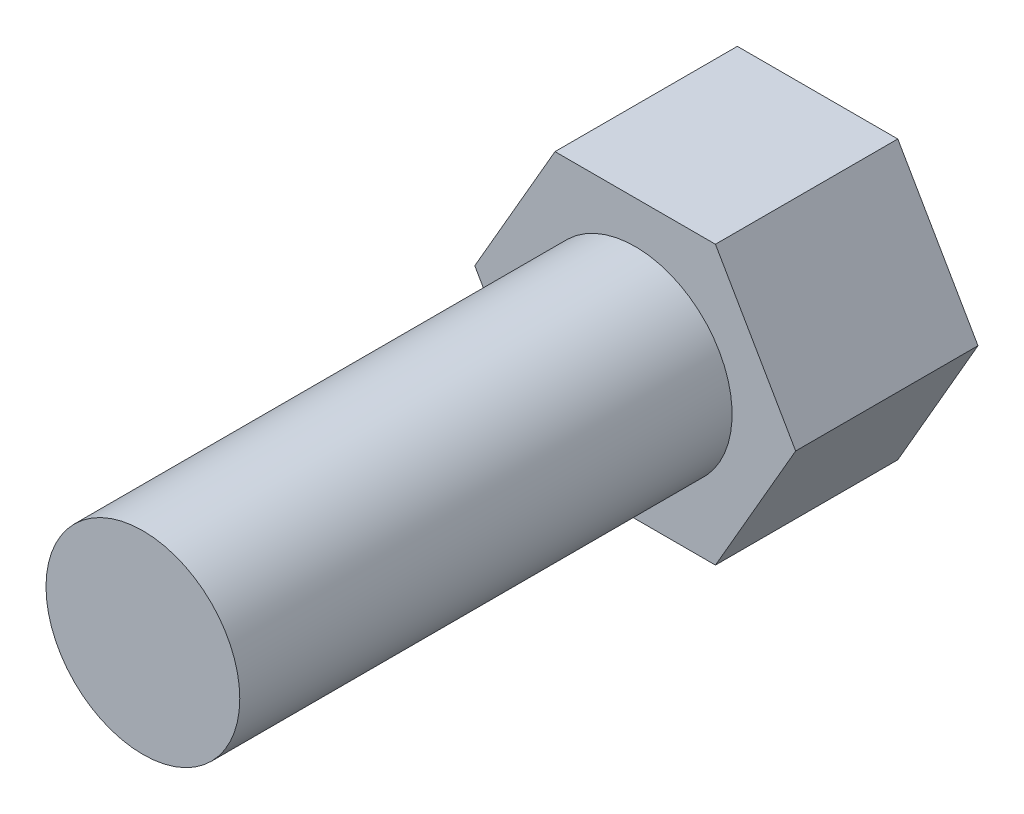
from build123d import *

# Parameters (mm, degrees)
EXTRUDE1_DEPTH      = 1.5
EXTRUDE1_DEPTH_BACK = 3.5
SKETCH2_R           = 2.656835516
EXTRUDE2_DEPTH      = 13.5


with BuildPart() as part:
    # Sketch1 → Extrude1 (new, two sides: drawn at the far end of the back side and taken through both)
    with BuildSketch(Plane.XY.offset(-EXTRUDE1_DEPTH_BACK)):
        Polygon((-2.458590949, 104.784469075), (-4.658295474, 108.594469075), (-9.057704526, 108.594469075), (-11.257409051, 104.784469075), (-9.057704526, 100.974469075), (-4.658295474, 100.974469075), align=None)
    extrude(amount=EXTRUDE1_DEPTH + EXTRUDE1_DEPTH_BACK)

    # Sketch2 → Extrude2 (add)
    with BuildSketch(Plane.XY.offset(1.5)):
        with Locations(Location((-6.858, 104.784469075, 0), (0, 0, 180))):
            Circle(SKETCH2_R)
    extrude(amount=EXTRUDE2_DEPTH)


solid = part.part
